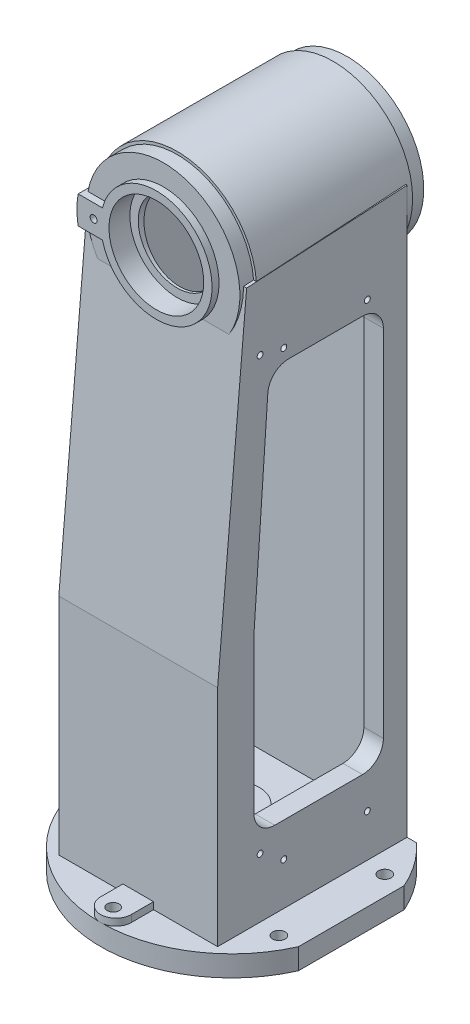
from build123d import *

# Parameters (mm, degrees)
EXTRUDE_1_DEPTH           = 15
SKETCH_2_R                = 4.5
CUT_EXTRUDE_1_DEPTH       = 129.284839323
EXTRUDE_2_DEPTH           = 5
HOLE_WIZARD_1_D           = 8.5
HOLE_WIZARD_1_DEPTH       = 60
HOLE_WIZARD_1_CBORE_D     = 14
HOLE_WIZARD_1_CBORE_DEPTH = 10
EXTRUDE_3_DEPTH           = 57
SKETCH_8_R                = 40
EXTRUDE_4_DEPTH           = 5
SKETCH_9_R                = 55
EXTRUDE_5_DEPTH           = 10
SKETCH_10_R               = 57
EXTRUDE_6_DEPTH           = 112
SKETCH_11_R               = 55
EXTRUDE_7_DEPTH           = 10
SKETCH_12_R               = 40
EXTRUDE_8_DEPTH           = 10
SKETCH_13_R               = 34
CUT_EXTRUDE_2_DEPTH       = 15
CUT_EXTRUDE_START         = -15
SKETCH_14_R               = 34
CUT_EXTRUDE_3_DEPTH       = 15
SKETCH_15_R               = 28
CUT_EXTRUDE_4_DEPTH       = 506.043562478
SKETCH_16_R               = 43
CUT_EXTRUDE_5_DEPTH       = 105
CUT_EXTRUDE_6_DEPTH       = 43
CUT_EXTRUDE_7_REACH       = 499.367
FILLET_1_R                = 15
SKETCH_19_R               = 20
EXTRUDE_10_DEPTH          = 13
M20X2_5_1_D               = 17.5
M20X2_5_1_DEPTH           = 42
M20X2_5_1_TIP             = 5.257530416
EXTRUDE_11_REACH          = 499.086
M6X1_0_1_D                = 5
M6X1_0_1_DEPTH            = 15
M6X1_0_1_TIP              = 1.502151548
CUT_EXTRUDE_8_DEPTH       = 3
SKETCH_26_R               = 15
CUT_EXTRUDE_9_DEPTH       = 495.316700102
CUT_EXTRUDE_10_DEPTH      = 2
SKETCH_28_R               = 12
EXTRUDE_12_DEPTH          = 14
M12X1_75_2_REACH          = 508.768
M12X1_75_2_BORE_R         = 5.1
M5X0_8_1_D                = 4.2
M5X0_8_1_DEPTH            = 14
M5X0_8_2_D                = 4.2
M5X0_8_2_DEPTH            = 14
M5X0_8_3_D                = 4.2
M5X0_8_3_DEPTH            = 14
M5X0_8_4_D                = 4.2
M5X0_8_4_DEPTH            = 14
M5X0_8_4_TIP              = 1.2618073
FILLET_2_R                = 5
M3X0_5_1_D                = 2.5
M3X0_5_1_DEPTH            = 7.5
M3X0_5_1_TIP              = 0.751075774


with BuildPart() as part:
    # 草图1 → 凸台-拉伸1 (new body)
    with BuildSketch(Plane(origin=(0, 0, 0), x_dir=(1, 0, 0), z_dir=(0, 1, 0))):
        with BuildLine():
            Line((-86, 37.947331922), (-86, -37.947331922))
            ThreePointArc((-86, -37.947331922), (0, -94), (86, -37.947331922))
            Line((86, -37.947331922), (86, 37.947331922))
            ThreePointArc((86, 37.947331922), (76.509824831, 54.609950598), (63.835726674, 69))
            Line((63.835726674, 69), (-63.835726674, 69))
            ThreePointArc((-63.835726674, 69), (-76.509824831, 54.609950598), (-86, 37.947331922))
        make_face()
    extrude(amount=EXTRUDE_1_DEPTH)

    # 草图2 → 切除-拉伸1 (cut, through all)
    with BuildSketch(Plane(origin=(0, 15, 0), x_dir=(1, 0, 0), z_dir=(0, 1, 0))):
        with Locations(Location((-72, 38, 0), (0, 0, 270))):
            Circle(SKETCH_2_R)
        with Locations(Location((-72, -38, 0), (0, 0, 90))):
            Circle(SKETCH_2_R)
        with Locations(Location((72, -38, 0), (0, 0, 270))):
            Circle(SKETCH_2_R)
        with Locations(Location((72, 38, 0), (0, 0, 90))):
            Circle(SKETCH_2_R)
    extrude(amount=-CUT_EXTRUDE_1_DEPTH, mode=Mode.SUBTRACT)

    # 草图3 → 凸台-拉伸2 (add)
    with BuildSketch(Plane(origin=(0, 15, 0), x_dir=(1, 0, 0), z_dir=(0, 1, 0))):
        with BuildLine():
            Line((-11, -65), (-11, -83))
            ThreePointArc((-11, -83), (0, -94), (11, -83))
            Line((11, -83), (11, -65))
            Line((11, -65), (-11, -65))
        make_face()
    extrude(amount=EXTRUDE_2_DEPTH)

    # 孔1
    with Locations(Plane.XZ):
        with Locations((0, 85)):
            CounterBoreHole(HOLE_WIZARD_1_D / 2, HOLE_WIZARD_1_CBORE_D / 2, HOLE_WIZARD_1_CBORE_DEPTH, depth=HOLE_WIZARD_1_DEPTH)

    # 草图7 → 凸台-拉伸3 (add, symmetric)
    with BuildSketch(Plane(origin=(0, 0, 0), x_dir=(0, 0, -1), z_dir=(1, 0, 0))):
        Polygon((-67, 15), (-67, 176), (-46.172040984, 414.06466091), (69, 420.444557243), (69, 15), align=None)
    extrude(amount=EXTRUDE_3_DEPTH, both=True)



with BuildPart() as body_2:
    # 草图8 → 凸台-拉伸4 (new body)
    with BuildSketch(Plane.XY.offset(54)):
        with Locations((0, 410)):
            Circle(SKETCH_8_R)
    extrude(amount=-EXTRUDE_4_DEPTH)


with BuildPart() as part_1:
    add(part.part)

    add(body_2.part)  # 凸台-拉伸5 merges body 2
    # 草图9 → 凸台-拉伸5 (add)
    with BuildSketch(Plane(origin=(0, 0, 49), x_dir=(-1, 0, 0), z_dir=(0, 0, -1))):
        with Locations((0, 410)):
            Circle(SKETCH_9_R)
    extrude(amount=EXTRUDE_5_DEPTH)

    # 草图10 → 凸台-拉伸6 (add)
    with BuildSketch(Plane(origin=(0, 0, 39), x_dir=(-1, 0, 0), z_dir=(0, 0, -1))):
        with Locations((0, 410)):
            Circle(SKETCH_10_R)
    extrude(amount=EXTRUDE_6_DEPTH)

    # 草图11 → 凸台-拉伸7 (add)
    with BuildSketch(Plane(origin=(0, 0, -73), x_dir=(-1, 0, 0), z_dir=(0, 0, -1))):
        with Locations((0, 410)):
            Circle(SKETCH_11_R)
    extrude(amount=EXTRUDE_7_DEPTH)

    # 草图12 → 凸台-拉伸8 (add)
    with BuildSketch(Plane(origin=(0, 0, -83), x_dir=(-1, 0, 0), z_dir=(0, 0, -1))):
        with Locations(Location((0, 410, 0), (0, 0, 180))):
            Circle(SKETCH_12_R)
    extrude(amount=EXTRUDE_8_DEPTH)

    # 草图13 → 切除-拉伸2 (cut)
    with BuildSketch(Plane.XY.offset(54)):
        with Locations((0, 410)):
            Circle(SKETCH_13_R)
    extrude(amount=-CUT_EXTRUDE_2_DEPTH, mode=Mode.SUBTRACT)

    # 草图14 → 切除-拉伸3 (cut)
    with BuildSketch(Plane(origin=(0, 0, -93), x_dir=(-1, 0, 0), z_dir=(0, 0, -1)).offset(CUT_EXTRUDE_START)):
        with Locations(Location((0, 410, 0), (0, 0, 180))):
            Circle(SKETCH_14_R)
    extrude(amount=CUT_EXTRUDE_3_DEPTH, mode=Mode.SUBTRACT)

    # 草图15 → 切除-拉伸4 (cut, through all)
    with BuildSketch(Plane(origin=(0, 0, -78), x_dir=(-1, 0, 0), z_dir=(0, 0, -1))):
        with Locations((0, 410)):
            Circle(SKETCH_15_R)
    extrude(amount=-CUT_EXTRUDE_4_DEPTH, mode=Mode.SUBTRACT)

    # 草图16 → 切除-拉伸5 (cut)
    with BuildSketch(Plane.XY.offset(34)):
        with Locations((0, 410)):
            Circle(SKETCH_16_R)
    extrude(amount=-CUT_EXTRUDE_5_DEPTH, mode=Mode.SUBTRACT)

    # 草图17 → 切除-拉伸6 (cut, symmetric)
    with BuildSketch(Plane(origin=(0, 0, 0), x_dir=(0, 0, -1), z_dir=(1, 0, 0))):
        Polygon((-55, 29), (-55, 179), (-34, 419.031098358), (57, 419.031098358), (57, 29), align=None)
    extrude(amount=CUT_EXTRUDE_6_DEPTH, both=True, mode=Mode.SUBTRACT)

    # 草图18 → 切除-拉伸7 (cut, up to next)
    with BuildSketch(Plane(origin=(57, 0, 0), x_dir=(0, 0, -1), z_dir=(1, 0, 0)), mode=Mode.PRIVATE) as cut_extrude_7_sk1:
        Polygon((-41, 70), (52, 70), (52, 355), (-30, 355), (-41, 195), align=None)
    cut_extrude_7_tool1 = extrude(cut_extrude_7_sk1.sketch, amount=-CUT_EXTRUDE_7_REACH, mode=Mode.PRIVATE) & part_1.part
    add(cut_extrude_7_tool1.solids().sort_by_distance((57, 209.437886, -6.970959))[0], mode=Mode.SUBTRACT)

    # 圆角1
    fillet_1_edges = [part_1.edges().sort_by_distance(p)[0] for p in [
        (50, 70, -52),
        (50, 355, -52),
        (50, 355, 30),
        (50, 70, 41),
    ]]
    fillet(fillet_1_edges, radius=FILLET_1_R)

    # 草图19 → 凸台-拉伸10 (add)
    with BuildSketch(Plane(origin=(0, 29, 0), x_dir=(1, 0, 0), z_dir=(0, 1, 0))):
        with Locations(Location((0, 0, 0), (0, 0, 90))):
            Circle(SKETCH_19_R)
    extrude(amount=EXTRUDE_10_DEPTH)

    # M20x2.5 螺纹孔1
    with Locations(Plane.XZ):
        with Locations((0, 0)):
            Hole(M20X2_5_1_D / 2, depth=M20X2_5_1_DEPTH)
            with Locations((0, 0, -(M20X2_5_1_DEPTH + M20X2_5_1_TIP / 2))):  # 118° drill point
                Cone(0, M20X2_5_1_D / 2, M20X2_5_1_TIP, mode=Mode.SUBTRACT)

    # 凸台-拉伸11: up to this face of the body (flat: up to its plane)
    extrude_11_end = Plane(part_1.part.faces().sort_by_distance((-33.038334778, 410, 39))[0])
    # 草图22 → 凸台-拉伸11 (add, up to the picked face)
    with BuildSketch(Plane.XY.offset(54), mode=Mode.PRIVATE) as extrude_11_sk1:
        with BuildLine():
            Line((-56.115951386, 420), (-38.729833462, 420))
            ThreePointArc((-38.729833462, 420), (-40, 410), (-38.729833462, 400))
            Line((-38.729833462, 400), (-56.115951386, 400))
            ThreePointArc((-56.115951386, 400), (-57, 410), (-56.115951386, 420))
        make_face()
    extrude_11_tool1 = split(extrude(extrude_11_sk1.sketch, amount=-EXTRUDE_11_REACH, mode=Mode.PRIVATE), bisect_by=extrude_11_end, keep=Keep.BOTH, mode=Mode.PRIVATE)
    add(extrude_11_tool1.solids().sort_by(Axis((-48.140644, 410, 54), (0, 0, -1)))[0])

    # M6x1.0 螺纹孔1
    with Locations(Plane.XY.offset(54)):
        with Locations((-45, 410)):
            Hole(M6X1_0_1_D / 2, depth=M6X1_0_1_DEPTH)
            with Locations((0, 0, -(M6X1_0_1_DEPTH + M6X1_0_1_TIP / 2))):  # 118° drill point
                Cone(0, M6X1_0_1_D / 2, M6X1_0_1_TIP, mode=Mode.SUBTRACT)

    # 草图25 → 切除-拉伸8 (cut)
    with BuildSketch(Plane(origin=(-43, 0, 0), x_dir=(0, 0, -1), z_dir=(1, 0, 0))):
        with BuildLine():
            Line((-8.5, 138), (-8.5, 93))
            ThreePointArc((-8.5, 93), (-31, 70.5), (-53.5, 93))
            Line((-53.5, 93), (-53.5, 138))
            ThreePointArc((-53.5, 138), (-31, 160.5), (-8.5, 138))
        make_face()
    extrude(amount=-CUT_EXTRUDE_8_DEPTH, mode=Mode.SUBTRACT)

    # 草图26 → 切除-拉伸9 (cut, through all)
    with BuildSketch(Plane(origin=(-46, 0, 0), x_dir=(0, 0, -1), z_dir=(1, 0, 0))):
        with Locations((-31, 138)):
            Circle(SKETCH_26_R)
        with Locations((-31, 93)):
            Circle(SKETCH_26_R)
    extrude(amount=-CUT_EXTRUDE_9_DEPTH, mode=Mode.SUBTRACT)

    # 草图27 → 切除-拉伸10 (cut)
    with BuildSketch(Plane.ZY.offset(57)):
        with BuildLine():
            Line((6, 138), (6, 68))
            Line((6, 68), (56, 68))
            Line((56, 68), (56, 138))
            ThreePointArc((56, 138), (31, 163), (6, 138))
        make_face()
    extrude(amount=-CUT_EXTRUDE_10_DEPTH, mode=Mode.SUBTRACT)

    # 草图28 → 凸台-拉伸12 (add)
    with BuildSketch(Plane(origin=(0, 0, -69), x_dir=(-1, 0, 0), z_dir=(0, 0, -1))):
        with Locations(Location((0, 20, 0), (0, 0, 180))):
            Circle(SKETCH_28_R)
    extrude(amount=EXTRUDE_12_DEPTH)

    # M12x1.75 螺纹孔2 bore → M12x1.75 螺纹孔2 (cut, up to next)
    with BuildSketch(Plane(origin=(0, 0, -83), x_dir=(-1, 0, 0), z_dir=(0, 0, -1)), mode=Mode.PRIVATE) as m12x1_75_2_sk1:
        with Locations((0, 20)):
            Circle(M12X1_75_2_BORE_R)
    m12x1_75_2_tool1 = extrude(m12x1_75_2_sk1.sketch, amount=-M12X1_75_2_REACH, mode=Mode.PRIVATE) & part_1.part
    add(m12x1_75_2_tool1.solids().sort_by_distance((0, 20, -83))[0], mode=Mode.SUBTRACT)

    # M5x0.8 螺纹孔1
    with Locations(Plane(origin=(57, 0, 0), x_dir=(0, 0, -1), z_dir=(1, 0, 0))):
        with Locations((-36.5, 367.5), (-36.5, 57.5)):
            Hole(M5X0_8_1_D / 2, depth=M5X0_8_1_DEPTH)

    # M5x0.8 螺纹孔2
    with Locations(Plane(origin=(57, 0, 0), x_dir=(0, 0, -1), z_dir=(1, 0, 0))):
        with Locations((40.5, 363.5), (-19.5, 363.5), (-19.5, 45.5), (40.5, 45.5)):
            Hole(M5X0_8_2_D / 2, depth=M5X0_8_2_DEPTH)

    # M5x0.8 螺纹孔3
    with Locations(Plane.ZY.offset(57)):
        with Locations((-24, 145), (-31.5, 315), (18.5, 315), (-57, 110), (-42, 110)):
            Hole(M5X0_8_3_D / 2, depth=M5X0_8_3_DEPTH)

    # M5x0.8 螺纹孔4
    with Locations(Plane.ZY.offset(57)):
        with Locations((36, 240), (-54, 240), (-54, 400), (36, 400)):
            Hole(M5X0_8_4_D / 2, depth=M5X0_8_4_DEPTH)
            with Locations((0, 0, -(M5X0_8_4_DEPTH + M5X0_8_4_TIP / 2))):  # 118° drill point
                Cone(0, M5X0_8_4_D / 2, M5X0_8_4_TIP, mode=Mode.SUBTRACT)

    # 圆角2
    fillet_2_edges = [part_1.edges().sort_by_distance(p)[0] for p in [
        (-56, 68, 56),
        (-56, 68, 6),
    ]]
    fillet(fillet_2_edges, radius=FILLET_2_R)

    # M3x0.5 螺纹孔1
    with Locations(Plane.ZY.offset(55)):
        with Locations((16, 108), (16, 78), (46, 78), (46, 108)):
            Hole(M3X0_5_1_D / 2, depth=M3X0_5_1_DEPTH)
            with Locations((0, 0, -(M3X0_5_1_DEPTH + M3X0_5_1_TIP / 2))):  # 118° drill point
                Cone(0, M3X0_5_1_D / 2, M3X0_5_1_TIP, mode=Mode.SUBTRACT)


solid = part_1.part
